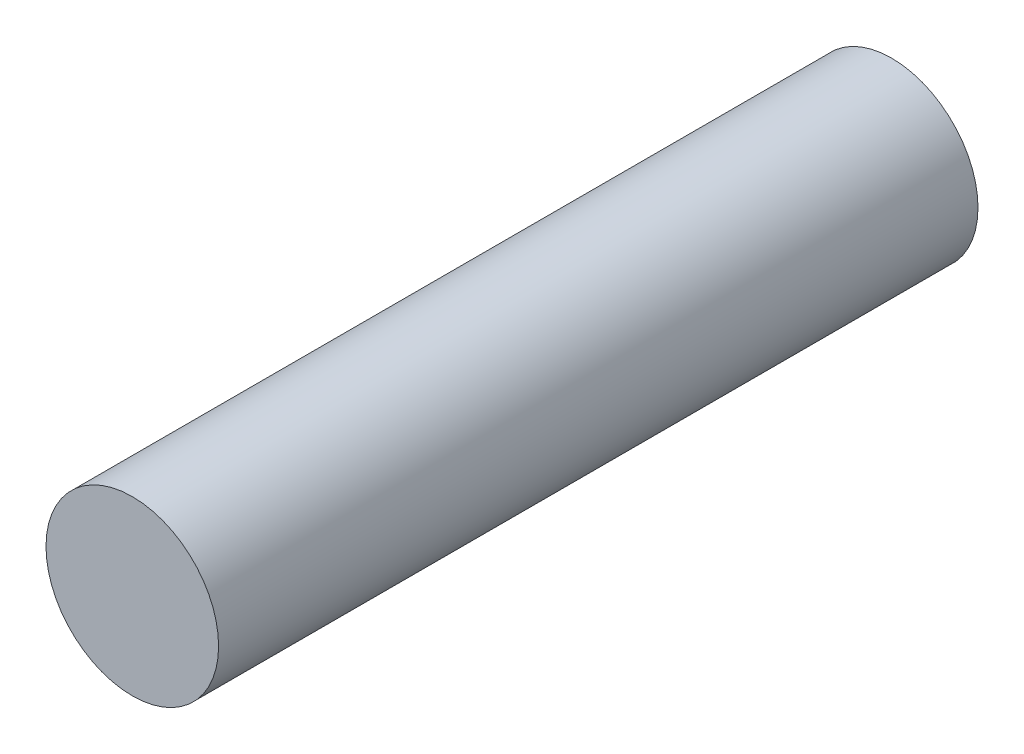
from build123d import *

# Parameters (mm, degrees)
ESQUISSE1_R        = 2.5
BOSS_EXTRU_1_DEPTH = 22


with BuildPart() as part:
    # Esquisse1 → Boss.-Extru.1 (new body)
    with BuildSketch(Plane.XY):
        Circle(ESQUISSE1_R)
    extrude(amount=BOSS_EXTRU_1_DEPTH)


solid = part.part
